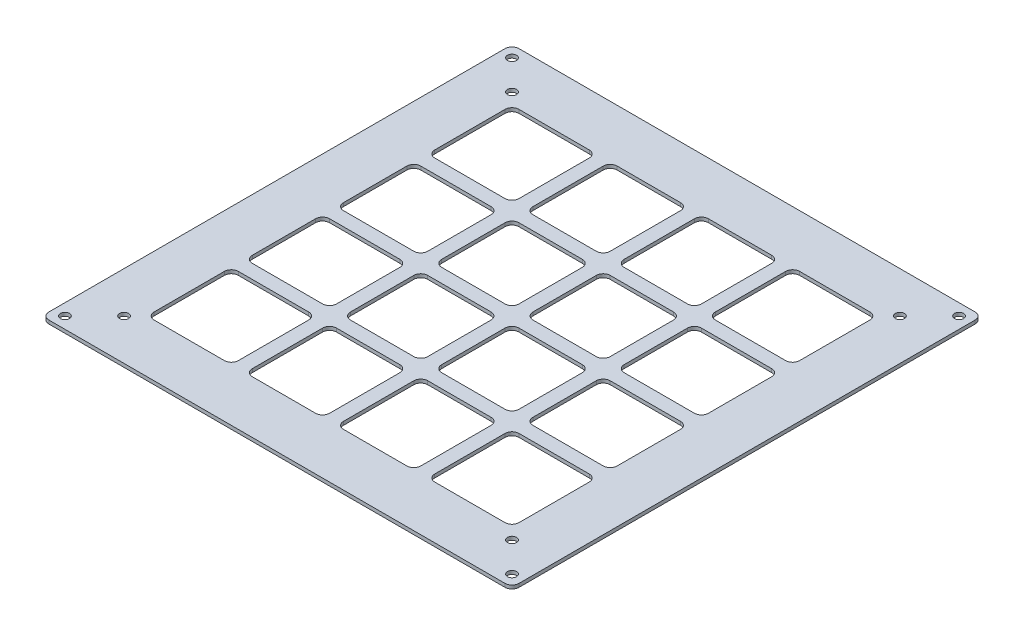
from build123d import *

# Parameters (mm, degrees)
SKETCH1_W           = 214.108538
SKETCH1_H           = 214.108538
SKETCH1_R           = 2.0701
BOSS_EXTRUDE1_DEPTH = 1.5875
SKETCH2_W           = 38.371842409
SKETCH2_H           = 38.371842409
SKETCH2_H_2         = 35.196842409
SKETCH2_W_2         = 35.196842409
CUT_EXTRUDE1_DEPTH  = 152.405921874
FILLET1_R           = 3.175
FILLET2_R           = 3.175


with BuildPart() as part:
    # Sketch1 → Boss-Extrude1 (new body)
    with BuildSketch(Plane(origin=(0, 0, 0), x_dir=(1, 0, 0), z_dir=(0, 1, 0))):
        Rectangle(SKETCH1_W, SKETCH1_H)
        with Locations(Location((-101.809169, 101.809169, 0), (0, 0, 270))):
            Circle(SKETCH1_R, mode=Mode.SUBTRACT)
        with Locations(Location((-101.809169, -101.809169, 0), (0, 0, 270))):
            Circle(SKETCH1_R, mode=Mode.SUBTRACT)
        with Locations(Location((101.809169, -101.809169, 0), (0, 0, 270))):
            Circle(SKETCH1_R, mode=Mode.SUBTRACT)
        with Locations(Location((101.809169, 101.809169, 0), (0, 0, 270))):
            Circle(SKETCH1_R, mode=Mode.SUBTRACT)
        with Locations(Location((-88.338784818, 88.338784818, 0), (0, 0, 270))):
            Circle(SKETCH1_R, mode=Mode.SUBTRACT)
        with Locations(Location((88.338784818, -88.338784818, 0), (0, 0, 90))):
            Circle(SKETCH1_R, mode=Mode.SUBTRACT)
        with Locations(Location((88.338784818, 88.338784818, 0), (0, 0, 270))):
            Circle(SKETCH1_R, mode=Mode.SUBTRACT)
        with Locations(Location((-88.338784818, -88.338784818, 0), (0, 0, 90))):
            Circle(SKETCH1_R, mode=Mode.SUBTRACT)
    extrude(amount=BOSS_EXTRUDE1_DEPTH)

    # Sketch2 → Cut-Extrude1 (cut, through all)
    with BuildSketch(Plane(origin=(0, 1.5875, 0), x_dir=(1, 0, 0), z_dir=(0, 1, 0))):
        with Locations((-63.907763614, 63.907763614)):
            Rectangle(SKETCH2_W, SKETCH2_H)
        with Locations((-63.907763614, 20.773421204)):
            Rectangle(SKETCH2_W, SKETCH2_H_2)
        with Locations((-20.773421204, 63.907763614)):
            Rectangle(SKETCH2_W_2, SKETCH2_H)
        with Locations((-20.773421204, 20.773421204)):
            Rectangle(SKETCH2_W_2, SKETCH2_H_2)
        with Locations((20.773421204, 63.907763614)):
            Rectangle(SKETCH2_W_2, SKETCH2_H)
        with Locations((20.773421204, 20.773421204)):
            Rectangle(SKETCH2_W_2, SKETCH2_H_2)
        with Locations((63.907763614, 63.907763614)):
            Rectangle(SKETCH2_W, SKETCH2_H)
        with Locations((63.907763614, 20.773421204)):
            Rectangle(SKETCH2_W, SKETCH2_H_2)
        with Locations((63.907763614, -20.773421204)):
            Rectangle(SKETCH2_W, SKETCH2_H_2)
        with Locations((20.773421204, -20.773421204)):
            Rectangle(SKETCH2_W_2, SKETCH2_H_2)
        with Locations((-20.773421204, -20.773421204)):
            Rectangle(SKETCH2_W_2, SKETCH2_H_2)
        with Locations((-63.907763614, -20.773421204)):
            Rectangle(SKETCH2_W, SKETCH2_H_2)
        with Locations((-63.907763614, -63.907763614)):
            Rectangle(SKETCH2_W, SKETCH2_H)
        with Locations((-20.773421204, -63.907763614)):
            Rectangle(SKETCH2_W_2, SKETCH2_H)
        with Locations((20.773421204, -63.907763614)):
            Rectangle(SKETCH2_W_2, SKETCH2_H)
        with Locations((63.907763614, -63.907763614)):
            Rectangle(SKETCH2_W, SKETCH2_H)
    extrude(amount=-CUT_EXTRUDE1_DEPTH, mode=Mode.SUBTRACT)

    # Fillet1
    fillet1_edges = [part.edges().sort_by_distance(p)[0] for p in [
        (-107.054269, 0.79375, -107.054269),
        (107.054269, 0.79375, -107.054269),
        (107.054269, 0.79375, 107.054269),
        (-107.054269, 0.79375, 107.054269),
    ]]
    fillet(fillet1_edges, radius=FILLET1_R)

    # Fillet2
    fillet2_edges = [part.edges().sort_by_distance(p)[0] for p in [
        (-44.721842409, 0.79375, -44.721842409),
        (-83.093684818, 0.79375, -44.721842409),
        (-83.093684818, 0.79375, -83.093684818),
        (-44.721842409, 0.79375, -83.093684818),
        (-44.721842409, 0.79375, -38.371842409),
        (-44.721842409, 0.79375, -3.175),
        (-83.093684818, 0.79375, -3.175),
        (-83.093684818, 0.79375, -38.371842409),
        (-3.175, 0.79375, -83.093684818),
        (-3.175, 0.79375, -44.721842409),
        (-38.371842409, 0.79375, -44.721842409),
        (-38.371842409, 0.79375, -83.093684818),
        (-3.175, 0.79375, -38.371842409),
        (-3.175, 0.79375, -3.175),
        (-38.371842409, 0.79375, -3.175),
        (-38.371842409, 0.79375, -38.371842409),
        (38.371842409, 0.79375, -44.721842409),
        (3.175, 0.79375, -44.721842409),
        (3.175, 0.79375, -83.093684818),
        (38.371842409, 0.79375, -83.093684818),
        (38.371842409, 0.79375, -3.175),
        (3.175, 0.79375, -3.175),
        (3.175, 0.79375, -38.371842409),
        (38.371842409, 0.79375, -38.371842409),
        (44.721842409, 0.79375, -44.721842409),
        (44.721842409, 0.79375, -83.093684818),
        (83.093684818, 0.79375, -83.093684818),
        (83.093684818, 0.79375, -44.721842409),
        (83.093684818, 0.79375, -38.371842409),
        (83.093684818, 0.79375, -3.175),
        (44.721842409, 0.79375, -3.175),
        (44.721842409, 0.79375, -38.371842409),
        (44.721842409, 0.79375, 38.371842409),
        (44.721842409, 0.79375, 3.175),
        (83.093684818, 0.79375, 3.175),
        (83.093684818, 0.79375, 38.371842409),
        (38.371842409, 0.79375, 38.371842409),
        (3.175, 0.79375, 38.371842409),
        (3.175, 0.79375, 3.175),
        (38.371842409, 0.79375, 3.175),
        (-3.175, 0.79375, 3.175),
        (-3.175, 0.79375, 38.371842409),
        (-38.371842409, 0.79375, 38.371842409),
        (-38.371842409, 0.79375, 3.175),
        (-44.721842409, 0.79375, 38.371842409),
        (-83.093684818, 0.79375, 38.371842409),
        (-83.093684818, 0.79375, 3.175),
        (-44.721842409, 0.79375, 3.175),
        (-44.721842409, 0.79375, 44.721842409),
        (-44.721842409, 0.79375, 83.093684818),
        (-83.093684818, 0.79375, 83.093684818),
        (-83.093684818, 0.79375, 44.721842409),
        (-3.175, 0.79375, 44.721842409),
        (-3.175, 0.79375, 83.093684818),
        (-38.371842409, 0.79375, 83.093684818),
        (-38.371842409, 0.79375, 44.721842409),
        (38.371842409, 0.79375, 83.093684818),
        (3.175, 0.79375, 83.093684818),
        (3.175, 0.79375, 44.721842409),
        (38.371842409, 0.79375, 44.721842409),
        (83.093684818, 0.79375, 44.721842409),
        (83.093684818, 0.79375, 83.093684818),
        (44.721842409, 0.79375, 83.093684818),
        (44.721842409, 0.79375, 44.721842409),
    ]]
    fillet(fillet2_edges, radius=FILLET2_R)


solid = part.part
